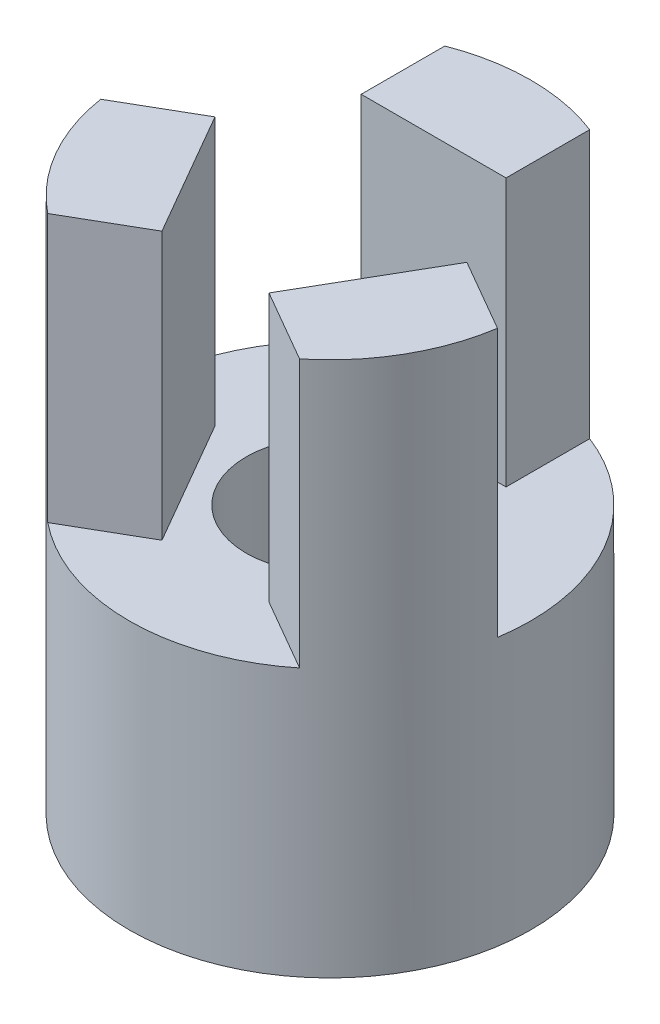
from build123d import *

# Parameters (mm, degrees)
BOSS_EXTRUDE1_DEPTH   = 10.16
BOSS_EXTRUDE1_2_DEPTH = 10.16
BOSS_EXTRUDE1_3_DEPTH = 10.16
BOSS_EXTRUDE2_START   = -10.16
SKETCH1_4_R           = 7.62
SKETCH1_4_R_2         = 3.175
BOSS_EXTRUDE2_DEPTH   = 10.16
CUT_EXTRUDE1_DEPTH    = 3.302


with BuildPart() as part:
    # Sketch1 → Boss-Extrude1 (new body)
    with BuildSketch(Plane(origin=(0, 0, 0), x_dir=(1, 0, 0), z_dir=(0, 1, 0))):
        with BuildLine():
            ThreePointArc((-7.529321681, -1.172055899), (-6.599113577, -3.81), (-4.779691024, -5.934555899))
            Line((-4.779691024, -5.934555899), (-2.031243586, -4.347739031))
            Line((-2.031243586, -4.347739031), (-4.780874243, 0.414760969))
            Line((-4.780874243, 0.414760969), (-7.529321681, -1.172055899))
        make_face()
    extrude(amount=BOSS_EXTRUDE1_DEPTH)



with BuildPart() as body_2:
    # Sketch1 → Boss-Extrude1 2 (new body)
    with BuildSketch(Plane(origin=(0, 0, 0), x_dir=(1, 0, 0), z_dir=(0, 1, 0))):
        with BuildLine():
            Line((2.031243586, -4.347739031), (4.779691024, -5.934555899))
            ThreePointArc((4.779691024, -5.934555899), (6.599113577, -3.81), (7.529321681, -1.172055899))
            Line((7.529321681, -1.172055899), (4.780874243, 0.414760969))
            Line((4.780874243, 0.414760969), (2.031243586, -4.347739031))
        make_face()
    extrude(amount=BOSS_EXTRUDE1_2_DEPTH)


with BuildPart() as body_3:
    # Sketch1 → Boss-Extrude1 3 (new body)
    with BuildSketch(Plane(origin=(0, 0, 0), x_dir=(1, 0, 0), z_dir=(0, 1, 0))):
        with BuildLine():
            ThreePointArc((2.749630657, 7.106611798), (0, 7.62), (-2.749630657, 7.106611798))
            Line((-2.749630657, 7.106611798), (-2.749630657, 3.932978062))
            Line((-2.749630657, 3.932978062), (2.749630657, 3.932978062))
            Line((2.749630657, 3.932978062), (2.749630657, 7.106611798))
        make_face()
    extrude(amount=BOSS_EXTRUDE1_3_DEPTH)


with BuildPart() as part_1:
    add(part.part)

    add(body_2.part)  # Boss-Extrude2 merges body 2

    add(body_3.part)  # Boss-Extrude2 merges body 3
    # Sketch1<4> → Boss-Extrude2 (add)
    with BuildSketch(Plane(origin=(0, 0, 0), x_dir=(1, 0, 0), z_dir=(0, 1, 0)).offset(BOSS_EXTRUDE2_START)):
        Circle(SKETCH1_4_R)
        Circle(SKETCH1_4_R_2, mode=Mode.SUBTRACT)
    extrude(amount=BOSS_EXTRUDE2_DEPTH)

    # Sketch2 → Cut-Extrude1 (cut)
    with BuildSketch(Plane.XZ.offset(10.16)):
        Polygon((6.35, 0), (3.175, 5.499261314), (-3.175, 5.499261314), (-6.35, 0), (-3.175, -5.499261314), (3.175, -5.499261314), align=None)
    extrude(amount=-CUT_EXTRUDE1_DEPTH, mode=Mode.SUBTRACT)


solid = part_1.part
